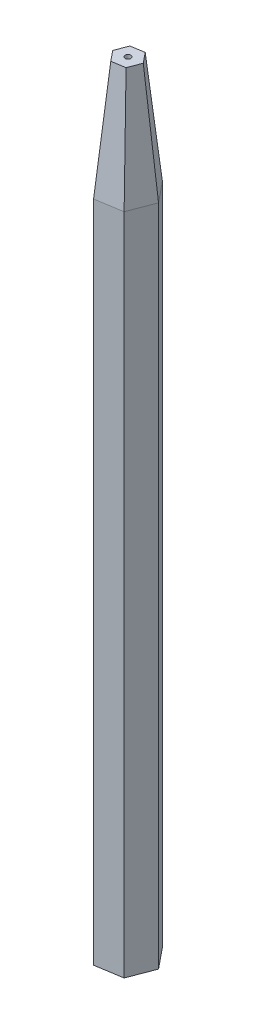
from build123d import *
from OCP.BRepFilletAPI import BRepFilletAPI_MakeChamfer

# Parameters (mm, degrees)
SKIZZE1_R                       = 0.5
AUFSATZ_LINEAR_AUSTRAGEN1_DEPTH = 135
FASE2_SIZE                      = 20
FASE2_SIZE2                     = 2


with BuildPart() as part:
    # Skizze1 → Aufsatz-Linear austragen1 (new body)
    with BuildSketch(Plane(origin=(0, 0, 0), x_dir=(1, 0, 0), z_dir=(0, 1, 0))):
        Polygon((2.912582575, -3.584717015), (4.560747288, 0.730011993), (1.648164713, 4.314729008), (-2.912582575, 3.584717015), (-4.560747288, -0.730011993), (-1.648164713, -4.314729008), align=None)
        with Locations(Location((0, 0, 0), (0, 0, 270))):
            Circle(SKIZZE1_R, mode=Mode.SUBTRACT)
    extrude(amount=AUFSATZ_LINEAR_AUSTRAGEN1_DEPTH)

    # Fase2: one chamfer whose edges measure the first distance from different faces: ONE call of the kernel's chamfer builder (chamfer() names one face for all edges)
    fase2_edges_1 = [part.edges().sort_by_distance(p)[0] for p in [
        (3.104456, 135, -2.5223705),
    ]]
    fase2_side_1 = [part.faces().sort_by_distance(p)[0] for p in [
        (3.104456, 67.5, -2.5223705),
    ]]
    fase2_edges_2 = [part.edges().sort_by_distance(p)[0] for p in [
        (-0.632208931, 135, -3.949723012),
    ]]
    fase2_side_2 = [part.faces().sort_by_distance(p)[0] for p in [
        (-0.632208931, 67.5, -3.949723012),
    ]]
    fase2_edges_3 = [part.edges().sort_by_distance(p)[0] for p in [
        (-3.736664931, 135, -1.427352511),
    ]]
    fase2_side_3 = [part.faces().sort_by_distance(p)[0] for p in [
        (-3.736664931, 67.5, -1.427352511),
    ]]
    fase2_edges_4 = [part.edges().sort_by_distance(p)[0] for p in [
        (-3.104456, 135, 2.5223705),
    ]]
    fase2_side_4 = [part.faces().sort_by_distance(p)[0] for p in [
        (-3.104456, 67.5, 2.5223705),
    ]]
    fase2_edges_5 = [part.edges().sort_by_distance(p)[0] for p in [
        (0.632208931, 135, 3.949723012),
    ]]
    fase2_side_5 = [part.faces().sort_by_distance(p)[0] for p in [
        (0.632208931, 67.5, 3.949723012),
    ]]
    fase2_edges_6 = [part.edges().sort_by_distance(p)[0] for p in [
        (3.736664931, 135, 1.427352511),
    ]]
    fase2_side_6 = [part.faces().sort_by_distance(p)[0] for p in [
        (3.736664931, 67.5, 1.427352511),
    ]]
    fase2 = BRepFilletAPI_MakeChamfer(part.part.solid().wrapped)
    for e in fase2_edges_1:
        fase2.Add(FASE2_SIZE, FASE2_SIZE2, e.wrapped, fase2_side_1[0].wrapped)  # the first distance lies on this face
    for e in fase2_edges_2:
        fase2.Add(FASE2_SIZE, FASE2_SIZE2, e.wrapped, fase2_side_2[0].wrapped)  # the first distance lies on this face
    for e in fase2_edges_3:
        fase2.Add(FASE2_SIZE, FASE2_SIZE2, e.wrapped, fase2_side_3[0].wrapped)  # the first distance lies on this face
    for e in fase2_edges_4:
        fase2.Add(FASE2_SIZE, FASE2_SIZE2, e.wrapped, fase2_side_4[0].wrapped)  # the first distance lies on this face
    for e in fase2_edges_5:
        fase2.Add(FASE2_SIZE, FASE2_SIZE2, e.wrapped, fase2_side_5[0].wrapped)  # the first distance lies on this face
    for e in fase2_edges_6:
        fase2.Add(FASE2_SIZE, FASE2_SIZE2, e.wrapped, fase2_side_6[0].wrapped)  # the first distance lies on this face
    add(Compound.cast(fase2.Shape()), mode=Mode.REPLACE)


solid = part.part
